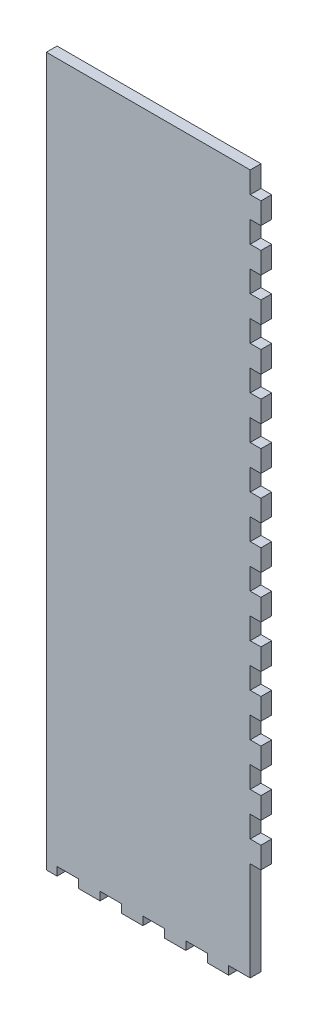
from build123d import *

# Parameters (mm, degrees)
ESQUISSE1_W             = 100
ESQUISSE1_H             = 330
BOSS_EXTRU_1_DEPTH      = 5
ESQUISSE3_W             = 5
ESQUISSE3_H             = 10
ESQUISSE3_W_2           = 10
ESQUISSE3_H_2           = 3.898354104
ENL_V_MAT_EXTRU_1_DEPTH = 345.85504201


with BuildPart() as part:
    # Esquisse1 → Boss.-Extru.1 (new body)
    with BuildSketch(Plane.XY):
        with Locations((50, 165)):
            Rectangle(ESQUISSE1_W, ESQUISSE1_H)
    extrude(amount=BOSS_EXTRU_1_DEPTH)

    # Esquisse3 → Enlèv. mat.-Extru.1 (cut, through all)
    with BuildSketch(Plane.XY):
        with Locations((97.5, 325)):
            Rectangle(ESQUISSE3_W, ESQUISSE3_H)
        with Locations((97.5, 305)):
            Rectangle(ESQUISSE3_W, ESQUISSE3_H)
        with Locations((97.5, 285)):
            Rectangle(ESQUISSE3_W, ESQUISSE3_H)
        with Locations((97.5, 265)):
            Rectangle(ESQUISSE3_W, ESQUISSE3_H)
        with Locations((97.5, 245)):
            Rectangle(ESQUISSE3_W, ESQUISSE3_H)
        with Locations((97.5, 225)):
            Rectangle(ESQUISSE3_W, ESQUISSE3_H)
        with Locations((97.5, 205)):
            Rectangle(ESQUISSE3_W, ESQUISSE3_H)
        with Locations((97.5, 185)):
            Rectangle(ESQUISSE3_W, ESQUISSE3_H)
        with Locations((97.5, 165)):
            Rectangle(ESQUISSE3_W, ESQUISSE3_H)
        with Locations((97.5, 145)):
            Rectangle(ESQUISSE3_W, ESQUISSE3_H)
        with Locations((97.5, 125)):
            Rectangle(ESQUISSE3_W, ESQUISSE3_H)
        with Locations((97.5, 105)):
            Rectangle(ESQUISSE3_W, ESQUISSE3_H)
        with Locations((97.5, 85)):
            Rectangle(ESQUISSE3_W, ESQUISSE3_H)
        with Locations((97.5, 65)):
            Rectangle(ESQUISSE3_W, ESQUISSE3_H)
        Polygon((100, 50), (100, 40), (100, 0), (85, 0), (85, 3.898354104), (95, 3.898354104), (95, 40), (95, 50), align=None)
        with Locations((70, 1.949177052)):
            Rectangle(ESQUISSE3_W_2, ESQUISSE3_H_2)
        with Locations((50, 1.949177052)):
            Rectangle(ESQUISSE3_W_2, ESQUISSE3_H_2)
        with Locations((30, 1.949177052)):
            Rectangle(ESQUISSE3_W_2, ESQUISSE3_H_2)
        with Locations((10, 1.949177052)):
            Rectangle(ESQUISSE3_W_2, ESQUISSE3_H_2)
    extrude(amount=ENL_V_MAT_EXTRU_1_DEPTH, mode=Mode.SUBTRACT)


solid = part.part
